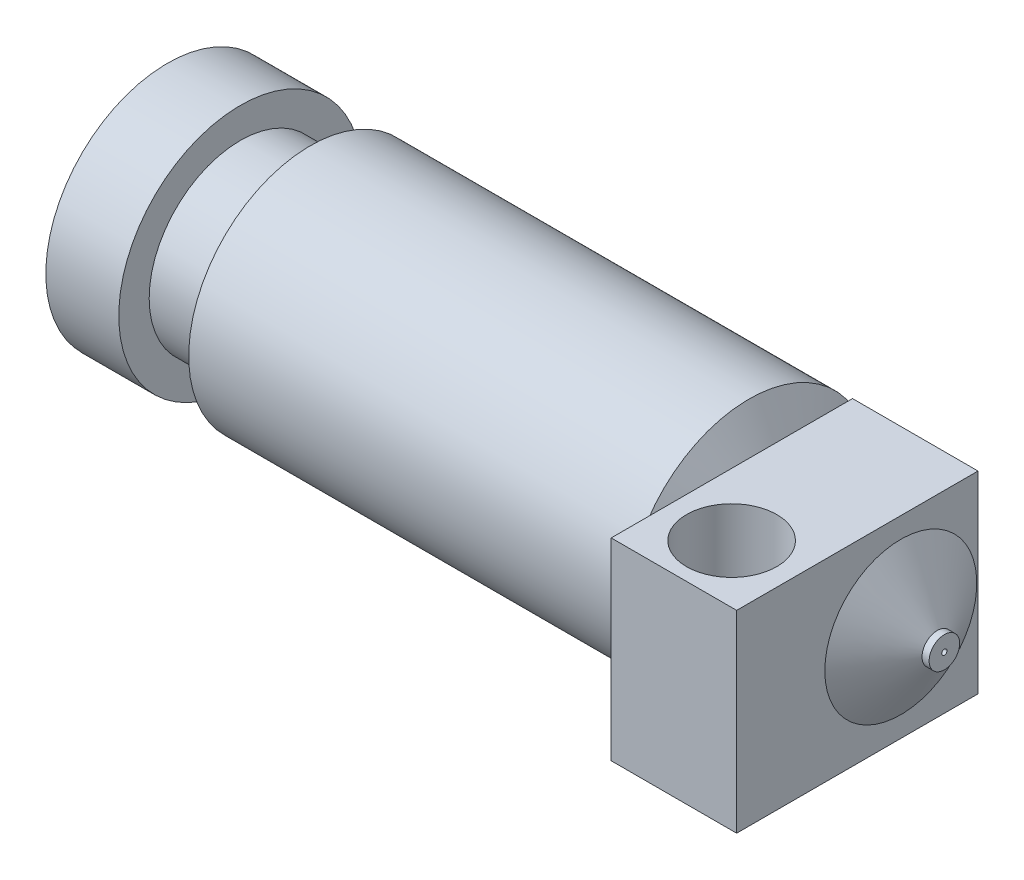
from build123d import *

# Parameters (mm, degrees)
SKETCH2_W           = 15.88
SKETCH2_H           = 12.7
SKETCH2_R           = 3.25
BOSS_EXTRUDE1_DEPTH = 8.255
SKETCH3_R           = 2.97
CUT_EXTRUDE1_DEPTH  = 44.847035248


with BuildPart() as part:
    # Sketch1 → Revolve1 (revolve)
    with BuildSketch(Plane(origin=(0, 0, 0), x_dir=(1, 0, 0), z_dir=(0, 1, 0))):
        Polygon((-40, 8), (-35.2, 8), (-35.2, 6), (-30.6, 6), (-30.6, 8), (-1.732050808, 8), (0, 5), (8.255, 5), (10.655438173, 1.005), (11.122943817, 1.005), (11.122943817, 0.175), (9.112544042, 0.175), (7.264897638, 3.25), (0, 3.25), (-40, 3.25), align=None)
    revolve(axis=Axis((0, 0, 0), (-1, 0, 0)))

    # Sketch2 → Boss-Extrude1 (add)
    with BuildSketch(Plane(origin=(0, 0, 0), x_dir=(0, 0, -1), z_dir=(1, 0, 0))):
        with Locations((-2.86, 0)):
            Rectangle(SKETCH2_W, SKETCH2_H)
        Circle(SKETCH2_R, mode=Mode.SUBTRACT)
    extrude(amount=BOSS_EXTRUDE1_DEPTH)

    # Sketch3 → Cut-Extrude1 (cut, through all)
    with BuildSketch(Plane(origin=(0, 6.35, 0), x_dir=(1, 0, 0), z_dir=(0, 1, 0))):
        with Locations(Location((4.115, -6.99, 0), (0, 0, 270))):
            Circle(SKETCH3_R)
    extrude(amount=-CUT_EXTRUDE1_DEPTH, mode=Mode.SUBTRACT)


solid = part.part
